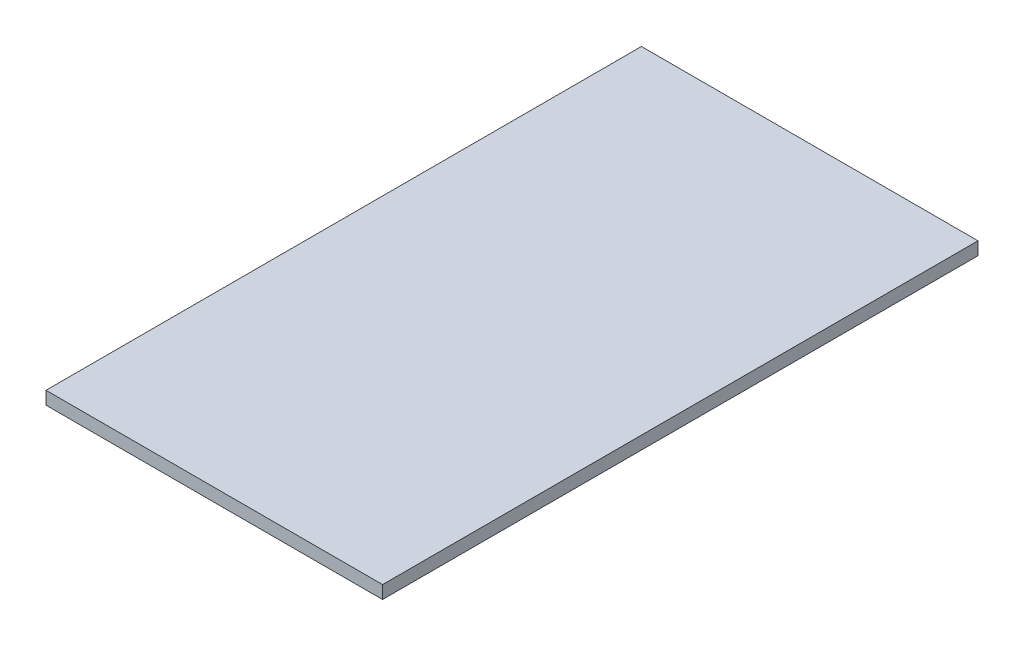
from build123d import *

# Parameters (mm, degrees)
SKETCH1_W           = 330.2
SKETCH1_H           = 584.2
BOSS_EXTRUDE1_DEPTH = 12.7


with BuildPart() as part:
    # Sketch1 → Boss-Extrude1 (new body)
    with BuildSketch(Plane(origin=(0, 0, 0), x_dir=(1, 0, 0), z_dir=(0, 1, 0))):
        Rectangle(SKETCH1_W, SKETCH1_H)
    extrude(amount=BOSS_EXTRUDE1_DEPTH)


solid = part.part
